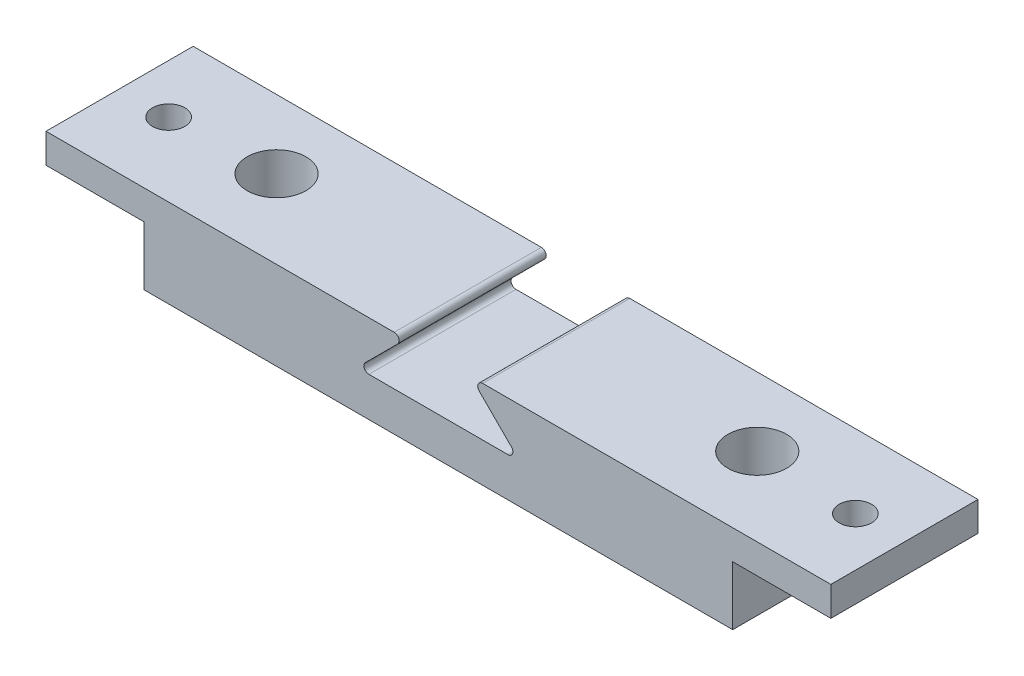
from build123d import *

# Parameters (mm, degrees)
SKETCH_1_W               = 60
SKETCH_1_H               = 15
SKETCH_1_R               = 3
EXTRUDE_1_DEPTH          = 6
EXTRUDE_START            = 6
SKETCH_1_3_W             = 80
SKETCH_1_3_H             = 15
SKETCH_1_3_R             = 1.65
SKETCH_1_3_R_2           = 3
EXTRUDE_2_DEPTH          = 3
CUT_EXTRUDE_1_DEPTH      = 42.680331093
CUT_EXTRUDE_1_DEPTH_BACK = 42.680331093


with BuildPart() as part:
    # Эскиз1 → Бобышка-Вытянуть1 (new body)
    with BuildSketch(Plane(origin=(0, 0, 0), x_dir=(1, 0, 0), z_dir=(0, 1, 0))):
        Rectangle(SKETCH_1_W, SKETCH_1_H)
        with Locations(Location((24.5, 0.5, 0), (0, 0, 270))):
            Circle(SKETCH_1_R, mode=Mode.SUBTRACT)
        with Locations(Location((-24.5, 0.5, 0), (0, 0, 270))):
            Circle(SKETCH_1_R, mode=Mode.SUBTRACT)
    extrude(amount=EXTRUDE_1_DEPTH)

    # Эскиз1<3> → Бобышка-Вытянуть2 (add)
    with BuildSketch(Plane(origin=(0, 0, 0), x_dir=(1, 0, 0), z_dir=(0, 1, 0)).offset(EXTRUDE_START)):
        Rectangle(SKETCH_1_3_W, SKETCH_1_3_H)
        with Locations(Location((-35, 0, 0), (0, 0, 270))):
            Circle(SKETCH_1_3_R, mode=Mode.SUBTRACT)
        with Locations(Location((24.5, 0.5, 0), (0, 0, 270))):
            Circle(SKETCH_1_3_R_2, mode=Mode.SUBTRACT)
        with Locations(Location((-24.5, 0.5, 0), (0, 0, 270))):
            Circle(SKETCH_1_3_R_2, mode=Mode.SUBTRACT)
        with Locations(Location((35, 0, 0), (0, 0, 270))):
            Circle(SKETCH_1_3_R, mode=Mode.SUBTRACT)
    extrude(amount=EXTRUDE_2_DEPTH)

    # Эскиз2 → Вырез-Вытянуть1 (cut, two sides: drawn at the far end of the back side and taken through both)
    with BuildSketch(Plane.XY.offset(-CUT_EXTRUDE_1_DEPTH_BACK)):
        with BuildLine():
            Line((4.153553391, 8.146446609), (7.446446609, 4.853553391))
            ThreePointArc((7.446446609, 4.853553391), (7.554832985, 4.308658284), (7.092893219, 4))
            Line((7.092893219, 4), (-7.092893219, 4))
            ThreePointArc((-7.092893219, 4), (-7.554832985, 4.308658284), (-7.446446609, 4.853553391))
            Line((-7.446446609, 4.853553391), (-4.153553391, 8.146446609))
            ThreePointArc((-4.153553391, 8.146446609), (-4.045167015, 8.691341716), (-4.507106781, 9))
            Line((-4.507106781, 9), (4.507106781, 9))
            ThreePointArc((4.507106781, 9), (4.045167015, 8.691341716), (4.153553391, 8.146446609))
        make_face()
    extrude(amount=CUT_EXTRUDE_1_DEPTH + CUT_EXTRUDE_1_DEPTH_BACK, mode=Mode.SUBTRACT)


solid = part.part
